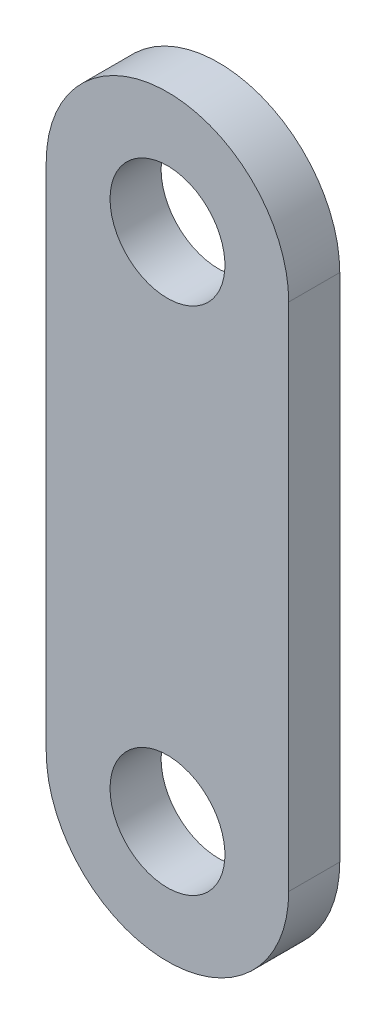
from build123d import *

# Parameters (mm, degrees)
BOSS_EXTRUDE1_DEPTH = 4
SKETCH2_R           = 4.5
CUT_EXTRUDE1_DEPTH  = 4


with BuildPart() as part:
    # Sketch1 → Boss-Extrude1 (new body)
    with BuildSketch(Plane.XY):
        with BuildLine():
            Line((-9.5, -20), (-9.5, 20))
            ThreePointArc((-9.5, 20), (0, 29.5), (9.5, 20))
            Line((9.5, 20), (9.5, -20))
            ThreePointArc((9.5, -20), (0, -29.5), (-9.5, -20))
        make_face()
    extrude(amount=BOSS_EXTRUDE1_DEPTH)

    # Sketch2 → Cut-Extrude1 (cut)
    with BuildSketch(Plane(origin=(0, 0, 0), x_dir=(-1, 0, 0), z_dir=(0, 0, -1))):
        with Locations((0, 20)):
            Circle(SKETCH2_R)
        with Locations((0, -20)):
            Circle(SKETCH2_R)
    extrude(amount=-CUT_EXTRUDE1_DEPTH, mode=Mode.SUBTRACT)


solid = part.part
